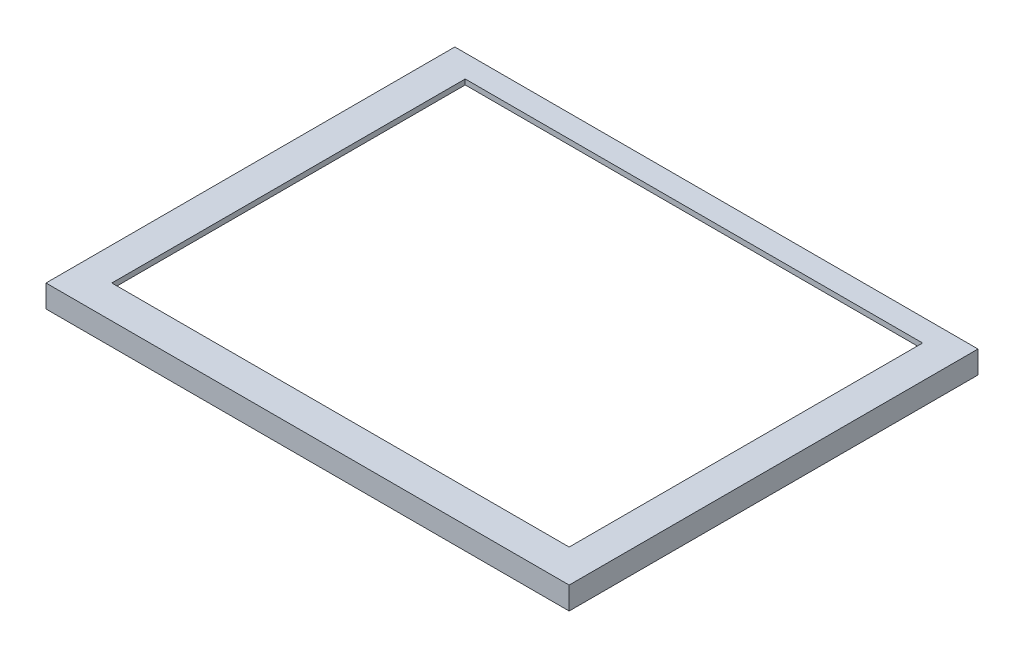
from build123d import *

# Parameters (mm, degrees)
SKETCH1_W           = 151
SKETCH1_H           = 118
SKETCH1_W_2         = 148
SKETCH1_H_2         = 115
BOSS_EXTRUDE1_DEPTH = 5
SKETCH2_W           = 151
SKETCH2_H           = 118
SKETCH2_W_2         = 132
SKETCH2_H_2         = 102
BOSS_EXTRUDE2_DEPTH = 1.5


with BuildPart() as part:
    # Sketch1 → Boss-Extrude1 (new body)
    with BuildSketch(Plane(origin=(0, 0, 0), x_dir=(1, 0, 0), z_dir=(0, 1, 0))):
        Rectangle(SKETCH1_W, SKETCH1_H)
        Rectangle(SKETCH1_W_2, SKETCH1_H_2, mode=Mode.SUBTRACT)
    extrude(amount=BOSS_EXTRUDE1_DEPTH)

    # Sketch2 → Boss-Extrude2 (add)
    with BuildSketch(Plane(origin=(0, 5, 0), x_dir=(1, 0, 0), z_dir=(0, 1, 0))):
        Rectangle(SKETCH2_W, SKETCH2_H)
        with Locations((0, 1.5)):
            Rectangle(SKETCH2_W_2, SKETCH2_H_2, mode=Mode.SUBTRACT)
    extrude(amount=BOSS_EXTRUDE2_DEPTH)


solid = part.part
